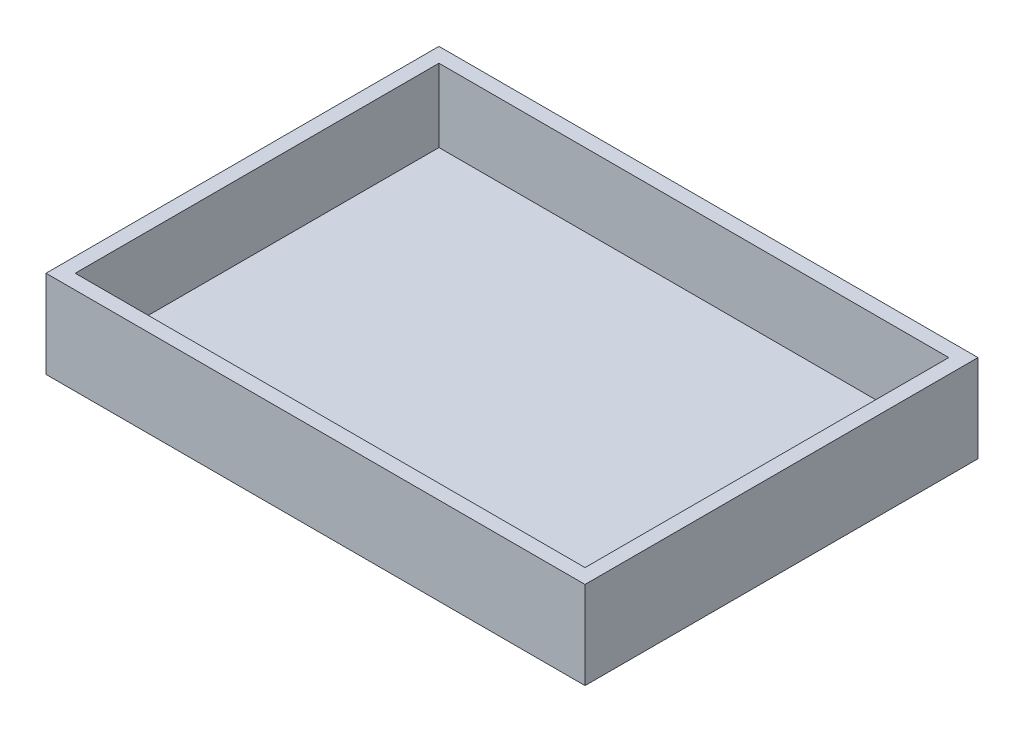
from build123d import *

# Parameters (mm, degrees)
SKETCH1_W           = 73.8
SKETCH1_H           = 53.8
SKETCH1_W_2         = 69.8
SKETCH1_H_2         = 49.8
BOSS_EXTRUDE1_DEPTH = 10
SKETCH2_W           = 73.8
SKETCH2_H           = 53.8
BOSS_EXTRUDE2_DEPTH = 2


with BuildPart() as part:
    # Sketch1 → Boss-Extrude1 (new body)
    with BuildSketch(Plane(origin=(0, 0, 0), x_dir=(1, 0, 0), z_dir=(0, 1, 0))):
        Rectangle(SKETCH1_W, SKETCH1_H)
        Rectangle(SKETCH1_W_2, SKETCH1_H_2, mode=Mode.SUBTRACT)
    extrude(amount=BOSS_EXTRUDE1_DEPTH)

    # Sketch2 → Boss-Extrude2 (add)
    with BuildSketch(Plane.XZ):
        Rectangle(SKETCH2_W, SKETCH2_H)
    extrude(amount=BOSS_EXTRUDE2_DEPTH)


solid = part.part
